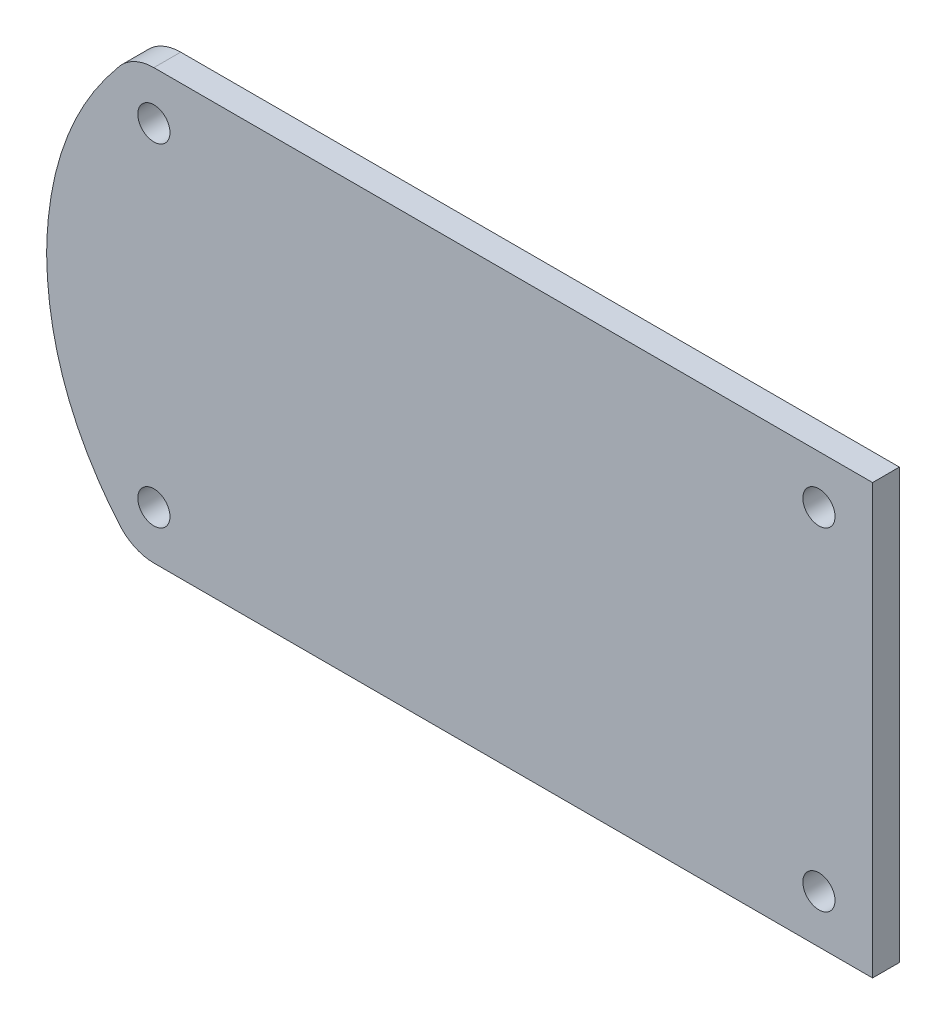
from build123d import *

# Parameters (mm, degrees)
CROQUIS1_R              = 2.25
CROQUIS1_R_2            = 3
CROQUIS1_R_3            = 1.5
CROQUIS1_R_4            = 2.249997567
SALIENTE_EXTRUIR1_DEPTH = 2.5
CROQUIS2_R              = 1.5
SALIENTE_EXTRUIR2_DEPTH = 2.5
CORTAR_EXTRUIR3_START   = -2.5
CROQUIS3_W              = 193.648563709
CROQUIS3_H              = 122.889896528
CORTAR_EXTRUIR3_DEPTH   = 2.5


with BuildPart() as part:
    # Croquis1 → Saliente-Extruir1 (new body)
    with BuildSketch(Plane.XY):
        with BuildLine():
            Line((-29.502526327, -44.949972179), (-23.17778065, -37.243838032))
            ThreePointArc((-23.17778065, -37.243838032), (-18.839723212, -32.444384768), (-14.046056443, -28.099933953))
            ThreePointArc((-14.046056443, -28.099933953), (-12.991422185, -27.658257217), (-11.867164621, -27.866527921))
            ThreePointArc((-11.867164621, -27.866527921), (-11.203313373, -28.112469078), (-10.500314, -28.196))
            Line((-10.500314, -28.196), (10.499686, -28.196))
            ThreePointArc((10.499686, -28.196), (11.203007921, -28.112542722), (11.867164264, -27.866528101))
            ThreePointArc((11.867164264, -27.866528101), (12.991422421, -27.658256674), (14.046057406, -28.099933523))
            ThreePointArc((14.046057406, -28.099933523), (18.839775902, -32.444337151), (23.177889012, -37.243749049))
            Line((23.177889012, -37.243749049), (29.502526012, -44.949972049))
            ThreePointArc((29.502526012, -44.949972049), (40.113877497, -46.255199126), (41.931739547, -35.719556022))
            Line((41.931739547, -35.719556022), (21.72923101, -5.566101046))
            ThreePointArc((21.72923101, -5.566101046), (20.036969431, -9.5e-08), (21.729230693, 5.566100954))
            Line((21.729230693, 5.566100954), (41.931739693, 35.719555954))
            ThreePointArc((41.931739693, 35.719555954), (40.113877277, 46.255198335), (29.502526336, 44.949972165))
            Line((29.502526336, 44.949972165), (23.17778065, 37.243838007))
            ThreePointArc((23.17778065, 37.243838007), (18.839723212, 32.444384742), (14.046056443, 28.099933927))
            ThreePointArc((14.046056443, 28.099933927), (12.991421988, 27.658257139), (11.867164252, 27.866528027))
            ThreePointArc((11.867164252, 27.866528027), (11.203313175, 28.112469073), (10.500314, 28.195999974))
            Line((10.500314, 28.195999974), (-10.500314, 28.195999974))
            ThreePointArc((-10.500314, 28.195999974), (-11.203313178, 28.112469098), (-11.867164264, 27.866528075))
            ThreePointArc((-11.867164264, 27.866528075), (-12.991422421, 27.658256648), (-14.046057406, 28.099933497))
            ThreePointArc((-14.046057406, 28.099933497), (-18.839775902, 32.444337126), (-23.177889012, 37.243749023))
            Line((-23.177889012, 37.243749023), (-29.502526012, 44.949972023))
            ThreePointArc((-29.502526012, 44.949972023), (-40.146302424, 46.230987494), (-41.886340556, 35.652554517))
            ThreePointArc((-41.886340556, 35.652554517), (-41.288874902, 25.337679941), (-50.13550001, 20.000000021))
            Line((-50.13550001, 20.000000021), (-97.31807601, 20.000000021))
            ThreePointArc((-97.31807601, 20.000000021), (-99.1994919, 19.554558541), (-100.681450855, 18.312809163))
            add(Edge.make_bspline(
                [(-107.31807554, 2.1e-08), (-107.252414123, 7.059743944), (-104.975710329, 13.164639039), (-100.681450855, 18.312809163)],
                knots=[0, 0, 0, 0, 1, 1, 1, 1], degree=3))
            add(Edge.make_bspline(
                [(-107.31807554, 2.1e-08), (-107.252414123, -7.059743902), (-104.975710329, -13.164638997), (-100.681450855, -18.312809121)],
                knots=[0, 0, 0, 0, 1, 1, 1, 1], degree=3))
            ThreePointArc((-100.681450855, -18.312809121), (-99.19949186, -19.554558345), (-97.31807601, -19.9999997))
            Line((-97.31807601, -19.9999997), (-50.13550001, -19.9999997))
            ThreePointArc((-50.13550001, -19.9999997), (-41.288874902, -25.33767962), (-41.886340556, -35.652554196))
            ThreePointArc((-41.886340556, -35.652554196), (-40.146302646, -46.230987042), (-29.502526327, -44.949972179))
        make_face()
        with Locations((-25.371621, 27.641642)):
            Circle(CROQUIS1_R, mode=Mode.SUBTRACT)
        with Locations((-35.493242035, 40.033284004)):
            Circle(CROQUIS1_R, mode=Mode.SUBTRACT)
        with Locations((-35.49324201, -40.0332837)):
            Circle(CROQUIS1_R, mode=Mode.SUBTRACT)
        with Locations((15.25, -15.25)):
            Circle(CROQUIS1_R_2, mode=Mode.SUBTRACT)
        with Locations((35.493242035, -40.03328403)):
            Circle(CROQUIS1_R, mode=Mode.SUBTRACT)
        with Locations((-15.25, 15.25)):
            Circle(CROQUIS1_R_2, mode=Mode.SUBTRACT)
        with Locations((-25.371621, -27.641642)):
            Circle(CROQUIS1_R, mode=Mode.SUBTRACT)
        with Locations((-35.318076, 15.5)):
            Circle(CROQUIS1_R_3, mode=Mode.SUBTRACT)
        with Locations((25.371621, -27.641642)):
            Circle(CROQUIS1_R, mode=Mode.SUBTRACT)
        with Locations((-15.25, -15.25)):
            Circle(CROQUIS1_R_2, mode=Mode.SUBTRACT)
        with Locations((-97.318076, 15.5)):
            Circle(CROQUIS1_R_3, mode=Mode.SUBTRACT)
        with Locations((15.25, 15.25)):
            Circle(CROQUIS1_R_2, mode=Mode.SUBTRACT)
        with Locations((-35.318076, -15.5)):
            Circle(CROQUIS1_R_3, mode=Mode.SUBTRACT)
        with Locations((25.371621, 27.641642)):
            Circle(CROQUIS1_R, mode=Mode.SUBTRACT)
        with Locations((-97.318076, -15.5)):
            Circle(CROQUIS1_R_3, mode=Mode.SUBTRACT)
        with Locations((35.493241695, 40.03328329)):
            Circle(CROQUIS1_R_4, mode=Mode.SUBTRACT)
        with BuildLine():
            Line((10.499686, -24.196), (-10.500314, -24.196))
            ThreePointArc((-10.500314, -24.196), (-11.500314, -25.196), (-10.500314, -26.196))
            Line((-10.500314, -26.196), (10.499686, -26.196))
            ThreePointArc((10.499686, -26.196), (11.499686, -25.196), (10.499686, -24.196))
        make_face(mode=Mode.SUBTRACT)
        with BuildLine():
            Line((10.499686, 24.196), (-10.500314, 24.196))
            ThreePointArc((-10.500314, 24.196), (-11.500314, 25.196), (-10.500314, 26.196))
            Line((-10.500314, 26.196), (10.499686, 26.196))
            ThreePointArc((10.499686, 26.196), (11.499686, 25.196), (10.499686, 24.196))
        make_face(mode=Mode.SUBTRACT)
        with BuildLine():
            Line((-85.514124, -4.165983), (-47.669779, -4.165983))
            ThreePointArc((-47.669779, -4.165983), (-45.229883846, -6.121043634), (-46.606106368, -8.928419991))
            ThreePointArc((-46.606106368, -8.928419991), (-47.664637652, -9.309528853), (-48.775706549, -9.486329166))
            ThreePointArc((-48.775706549, -9.486329166), (-65.20554454, -10.947799765), (-81.54268179, -13.222314916))
            ThreePointArc((-81.54268179, -13.222314916), (-86.502756567, -11.787005843), (-88.511039815, -7.029984473))
            ThreePointArc((-88.511039815, -7.029984473), (-87.586803958, -4.997112835), (-85.514124, -4.165983))
        make_face(mode=Mode.SUBTRACT)
        with BuildLine():
            Line((-85.514123843, 4.165983), (-47.669779, 4.165983))
            ThreePointArc((-47.669779, 4.165983), (-45.229893438, 6.121044064), (-46.606108087, 8.928416245))
            ThreePointArc((-46.606108087, 8.928416245), (-47.664639263, 9.309527068), (-48.775708446, 9.48632916))
            ThreePointArc((-48.775708446, 9.48632916), (-65.205546063, 10.947798842), (-81.542682989, 13.222313035))
            ThreePointArc((-81.542682989, 13.222313035), (-86.502748912, 11.786999538), (-88.511029539, 7.029984958))
            ThreePointArc((-88.511029539, 7.029984958), (-87.586797502, 4.997116506), (-85.514123843, 4.165983))
        make_face(mode=Mode.SUBTRACT)
    extrude(amount=SALIENTE_EXTRUIR1_DEPTH)

    # Croquis2 → Saliente-Extruir2 (add)
    with BuildSketch(Plane.XY.offset(2.5)):
        with BuildLine():
            Line((-50.13550001, 20.000000021), (-30.318076, 20.000000021))
            Line((-30.318076, 20.000000021), (-30.318076, -19.9999997))
            Line((-30.318076, -19.9999997), (-50.13550001, -19.9999997))
            Line((-50.13550001, -19.9999997), (-97.31807601, -19.9999997))
            ThreePointArc((-97.31807601, -19.9999997), (-99.19949186, -19.554558345), (-100.681450855, -18.312809121))
            add(Edge.make_bspline(
                [(-107.31807554, 2.1e-08), (-107.252414123, -7.059743902), (-104.975710329, -13.164638997), (-100.681450855, -18.312809121)],
                knots=[0, 0, 0, 0, 1, 1, 1, 1], degree=3))
            add(Edge.make_bspline(
                [(-100.681450855, 18.312809163), (-104.975710329, 13.164639039), (-107.252414123, 7.059743944), (-107.31807554, 2.1e-08)],
                knots=[0, 0, 0, 0, 1, 1, 1, 1], degree=3))
            ThreePointArc((-100.681450855, 18.312809163), (-99.1994919, 19.554558541), (-97.31807601, 20.000000021))
            Line((-97.31807601, 20.000000021), (-50.13550001, 20.000000021))
        make_face()
        with Locations((-35.318076, 15.5)):
            Circle(CROQUIS2_R, mode=Mode.SUBTRACT)
        with Locations((-35.318076, -15.5)):
            Circle(CROQUIS2_R, mode=Mode.SUBTRACT)
        with Locations((-97.318076, -15.5)):
            Circle(CROQUIS2_R, mode=Mode.SUBTRACT)
        with Locations((-97.318076, 15.5)):
            Circle(CROQUIS2_R, mode=Mode.SUBTRACT)
    extrude(amount=SALIENTE_EXTRUIR2_DEPTH)

    # Croquis3 → Cortar-Extruir3 (cut)
    with BuildSketch(Plane.XY.offset(2.5).offset(CORTAR_EXTRUIR3_START)):
        with Locations((-31.186912947, -1.649898241)):
            Rectangle(CROQUIS3_W, CROQUIS3_H)
    extrude(amount=CORTAR_EXTRUIR3_DEPTH, mode=Mode.SUBTRACT)


solid = part.part
